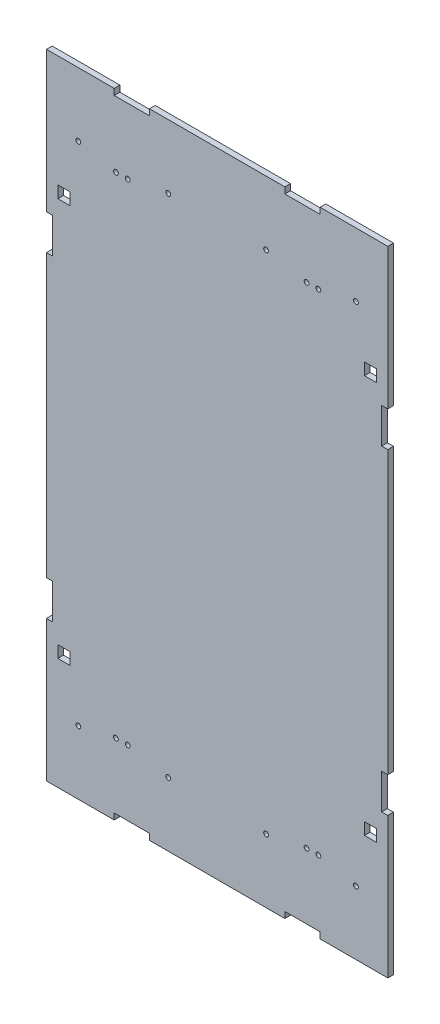
from build123d import *

# Parameters (mm, degrees)
SKETCH1_W           = 300
SKETCH1_H           = 557
SKETCH1_W_2         = 290
SKETCH1_H_2         = 547
BOSS_EXTRUDE1_DEPTH = 150
SKETCH2_W           = 300
SKETCH2_H           = 557
BOSS_EXTRUDE2_DEPTH = 5
SKETCH5_R           = 2.1
CUT_EXTRUDE3_DEPTH  = 10
SKETCH6_W           = 10.5
SKETCH6_H           = 10.5
CUT_EXTRUDE4_DEPTH  = 10
SKETCH8_R           = 1.25
CUT_EXTRUDE6_DEPTH  = 663
SKETCH9_W           = 300
SKETCH9_H           = 557
CUT_EXTRUDE7_DEPTH  = 150
SKETCH10_W          = 31
SKETCH10_H          = 10.8
CUT_EXTRUDE8_DEPTH  = 5
SKETCH13_W          = 10.8
SKETCH13_H          = 31
CUT_EXTRUDE10_DEPTH = 5
SKETCH16_R          = 2.1
CUT_EXTRUDE12_DEPTH = 10


with BuildPart() as part:
    # Sketch1 → Boss-Extrude1 (new body)
    with BuildSketch(Plane.XY):
        with Locations((86.356154307, 86.715846067)):
            Rectangle(SKETCH1_W, SKETCH1_H)
        with Locations((86.356154307, 86.715846067)):
            Rectangle(SKETCH1_W_2, SKETCH1_H_2, mode=Mode.SUBTRACT)
    extrude(amount=BOSS_EXTRUDE1_DEPTH)

    # Sketch2 → Boss-Extrude2 (add)
    with BuildSketch(Plane.XY.offset(150)):
        with Locations((86.356154307, 86.715846067)):
            Rectangle(SKETCH2_W, SKETCH2_H)
    extrude(amount=BOSS_EXTRUDE2_DEPTH)

    # Sketch5 → Cut-Extrude3 (cut)
    with BuildSketch(Plane.XY.offset(155)):
        with Locations((7.766154307, 302.101499848)):
            Circle(SKETCH5_R)
        with Locations((-2.643845693, 302.101499848)):
            Circle(SKETCH5_R)
        with Locations((175.356154307, 302.101499848)):
            Circle(SKETCH5_R)
        with Locations((164.946154307, 302.101499848)):
            Circle(SKETCH5_R)
        with Locations((-2.643845693, -128.669807714)):
            Circle(SKETCH5_R)
        with Locations((7.766154307, -128.669807714)):
            Circle(SKETCH5_R)
        with Locations((164.946154307, -128.669807714)):
            Circle(SKETCH5_R)
        with Locations((175.356154307, -128.669807714)):
            Circle(SKETCH5_R)
    extrude(amount=-CUT_EXTRUDE3_DEPTH, mode=Mode.SUBTRACT)

    # Sketch6 → Cut-Extrude4 (cut)
    with BuildSketch(Plane.XY.offset(155)):
        with Locations((-48.393845693, 261.715846067)):
            Rectangle(SKETCH6_W, SKETCH6_H)
        with Locations((221.106154307, 261.715846067)):
            Rectangle(SKETCH6_W, SKETCH6_H)
        with Locations((221.106154307, -88.284153933)):
            Rectangle(SKETCH6_W, SKETCH6_H)
        with Locations((-48.393845693, -88.284153933)):
            Rectangle(SKETCH6_W, SKETCH6_H)
    extrude(amount=-CUT_EXTRUDE4_DEPTH, mode=Mode.SUBTRACT)

    # Sketch8 → Cut-Extrude6 (cut)
    with BuildSketch(Plane.XZ.offset(191.784153933)):
        with Locations(Location((91.506154307, 9.8, 0), (0, 0, 270))):
            Circle(SKETCH8_R)
        with Locations(Location((81.206154307, 9.8, 0), (0, 0, 270))):
            Circle(SKETCH8_R)
    extrude(amount=-CUT_EXTRUDE6_DEPTH, mode=Mode.SUBTRACT)

    # Sketch9 → Cut-Extrude7 (cut)
    with BuildSketch(Plane(origin=(0, 0, 0), x_dir=(-1, 0, 0), z_dir=(0, 0, -1))):
        with Locations((-86.356154307, 86.715846067)):
            Rectangle(SKETCH9_W, SKETCH9_H)
    extrude(amount=-CUT_EXTRUDE7_DEPTH, mode=Mode.SUBTRACT)

    # Sketch10 → Cut-Extrude8 (cut)
    with BuildSketch(Plane(origin=(0, 0, 150), x_dir=(-1, 0, 0), z_dir=(0, 0, -1))):
        with Locations((-11.356154307, -191.784153933)):
            Rectangle(SKETCH10_W, SKETCH10_H)
        with Locations((-161.356154307, -191.784153933)):
            Rectangle(SKETCH10_W, SKETCH10_H)
        with Locations((-161.356154307, 365.215846067)):
            Rectangle(SKETCH10_W, SKETCH10_H)
        with Locations((-11.356154307, 365.215846067)):
            Rectangle(SKETCH10_W, SKETCH10_H)
    extrude(amount=-CUT_EXTRUDE8_DEPTH, mode=Mode.SUBTRACT)

    # Sketch13 → Cut-Extrude10 (cut)
    with BuildSketch(Plane(origin=(0, 0, 150), x_dir=(-1, 0, 0), z_dir=(0, 0, -1))):
        with Locations((63.643845693, -52.534153933)):
            Rectangle(SKETCH13_W, SKETCH13_H)
        with Locations((63.643845693, 225.965846067)):
            Rectangle(SKETCH13_W, SKETCH13_H)
        with Locations((-236.356154307, 225.965846067)):
            Rectangle(SKETCH13_W, SKETCH13_H)
        with Locations((-236.356154307, -52.534153933)):
            Rectangle(SKETCH13_W, SKETCH13_H)
    extrude(amount=-CUT_EXTRUDE10_DEPTH, mode=Mode.SUBTRACT)

    # Sketch16 → Cut-Extrude12 (cut)
    with BuildSketch(Plane.XY.offset(155)):
        with Locations((208.356154307, 309.215846067)):
            Circle(SKETCH16_R)
        with Locations((129.356358153, 309.036381593)):
            Circle(SKETCH16_R)
        with Locations(Location((43.355950462, 309.036381593, 0), (0, 0, 180))):
            Circle(SKETCH16_R)
        with Locations(Location((-35.643845693, 309.215846067, 0), (0, 0, 180))):
            Circle(SKETCH16_R)
        with Locations((-35.643845693, -135.784153933)):
            Circle(SKETCH16_R)
        with Locations((43.355950462, -135.604689459)):
            Circle(SKETCH16_R)
        with Locations(Location((129.356358153, -135.604689459, 0), (0, 0, 180))):
            Circle(SKETCH16_R)
        with Locations(Location((208.356154307, -135.784153933, 0), (0, 0, 180))):
            Circle(SKETCH16_R)
    extrude(amount=-CUT_EXTRUDE12_DEPTH, mode=Mode.SUBTRACT)


solid = part.part
